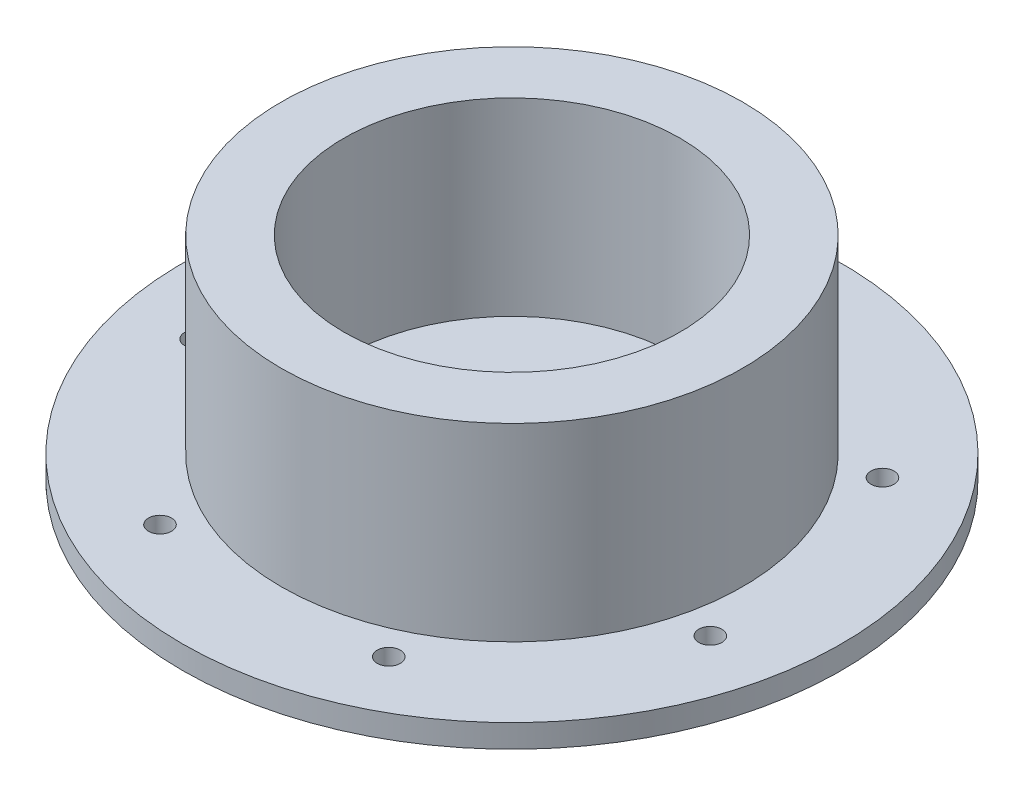
from build123d import *

# Parameters (mm, degrees)
SKETCH1_R           = 50
SKETCH1_R_2         = 1.75
BOSS_EXTRUDE1_DEPTH = 3.5
SKETCH2_R           = 35
SKETCH2_R_2         = 25.5
BOSS_EXTRUDE3_DEPTH = 28.7


with BuildPart() as part:
    # Sketch1 → Boss-Extrude1 (new body)
    with BuildSketch(Plane(origin=(0, 0, 0), x_dir=(1, 0, 0), z_dir=(0, 1, 0))):
        with Locations(Location((0, 0, 0), (0, 0, 270))):
            Circle(SKETCH1_R)
        with Locations(Location((0, 40, 0), (0, 0, 270))):
            Circle(SKETCH1_R_2, mode=Mode.SUBTRACT)
        with Locations(Location((31.273259299, 24.939592074, 0), (0, 0, 270))):
            Circle(SKETCH1_R_2, mode=Mode.SUBTRACT)
        with Locations(Location((38.997116487, -8.900837358, 0), (0, 0, 270))):
            Circle(SKETCH1_R_2, mode=Mode.SUBTRACT)
        with Locations(Location((17.355349565, -36.038754716, 0), (0, 0, 270))):
            Circle(SKETCH1_R_2, mode=Mode.SUBTRACT)
        with Locations(Location((-17.355349565, -36.038754716, 0), (0, 0, 270))):
            Circle(SKETCH1_R_2, mode=Mode.SUBTRACT)
        with Locations(Location((-38.997116487, -8.900837358, 0), (0, 0, 270))):
            Circle(SKETCH1_R_2, mode=Mode.SUBTRACT)
        with Locations(Location((-31.273259299, 24.939592074, 0), (0, 0, 270))):
            Circle(SKETCH1_R_2, mode=Mode.SUBTRACT)
    extrude(amount=BOSS_EXTRUDE1_DEPTH)

    # Sketch2 → Boss-Extrude3 (add)
    with BuildSketch(Plane(origin=(0, 3.5, 0), x_dir=(1, 0, 0), z_dir=(0, 1, 0))):
        with Locations(Location((0, 0, 0), (0, 0, 270))):
            Circle(SKETCH2_R)
        with Locations(Location((0, 0, 0), (0, 0, 270))):
            Circle(SKETCH2_R_2, mode=Mode.SUBTRACT)
    extrude(amount=BOSS_EXTRUDE3_DEPTH)


solid = part.part
